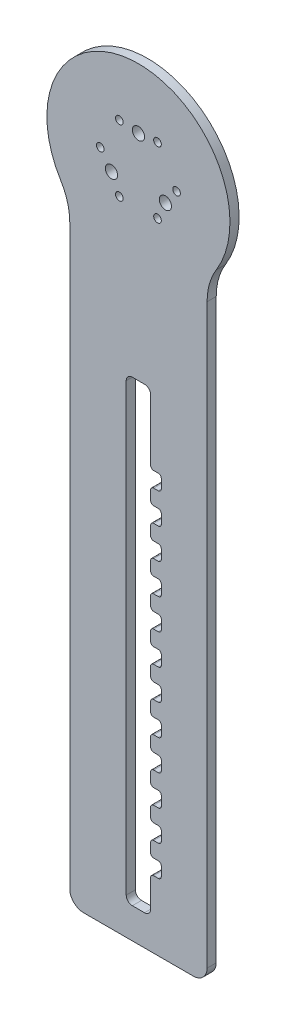
from build123d import *

# Parameters (mm, degrees)
SKETCH_1_R          = 1.25
SKETCH_1_R_2        = 2
EXTRUDE_1_DEPTH     = 3
SKETCH_2_R          = 2.5
CUT_EXTRUDE_1_DEPTH = 1
CUT_EXTRUDE_2_DEPTH = 10


with BuildPart() as part:
    # 草图1 → 凸台-拉伸1 (new body)
    with BuildSketch(Plane.XY):
        with BuildLine():
            Line((-17.988253832, -110), (17.988253832, -110))
            ThreePointArc((17.988253832, -110), (21.178540142, -108.678540142), (22.5, -105.488253832))
            Line((22.5, -105.488253832), (22.5, 83.660865618))
            ThreePointArc((22.5, 83.660865618), (23.264615938, 89.138091193), (25.5, 94.196519371))
            ThreePointArc((25.5, 94.196519371), (0, 140), (-25.5, 94.196519371))
            ThreePointArc((-25.5, 94.196519371), (-23.264615938, 89.138091193), (-22.5, 83.660865618))
            Line((-22.5, 83.660865618), (-22.5, -105.488253832))
            ThreePointArc((-22.5, -105.488253832), (-21.178540142, -108.678540142), (-17.988253832, -110))
        make_face()
        with Locations((12.5, 110)):
            Circle(SKETCH_1_R, mode=Mode.SUBTRACT)
        with Locations((6.25, 120.825317547)):
            Circle(SKETCH_1_R, mode=Mode.SUBTRACT)
        with Locations((-6.25, 120.825317547)):
            Circle(SKETCH_1_R, mode=Mode.SUBTRACT)
        with Locations((-12.5, 110)):
            Circle(SKETCH_1_R, mode=Mode.SUBTRACT)
        with Locations((-6.25, 99.174682453)):
            Circle(SKETCH_1_R, mode=Mode.SUBTRACT)
        with Locations((6.25, 99.174682453)):
            Circle(SKETCH_1_R, mode=Mode.SUBTRACT)
        with Locations((0, 120.2)):
            Circle(SKETCH_1_R_2, mode=Mode.SUBTRACT)
        with Locations((-8.833459119, 104.9)):
            Circle(SKETCH_1_R_2, mode=Mode.SUBTRACT)
        with Locations((8.833459119, 104.9)):
            Circle(SKETCH_1_R_2, mode=Mode.SUBTRACT)
    extrude(amount=EXTRUDE_1_DEPTH)

    # 草图2 → 切除-拉伸1 (cut)
    with BuildSketch(Plane(origin=(0, 0, 0), x_dir=(-1, 0, 0), z_dir=(0, 0, -1))):
        with Locations((-6.25, 120.825317547)):
            Circle(SKETCH_2_R)
        with Locations((6.25, 120.825317547)):
            Circle(SKETCH_2_R)
        with Locations((12.5, 110)):
            Circle(SKETCH_2_R)
        with Locations((6.25, 99.174682453)):
            Circle(SKETCH_2_R)
        with Locations((-6.25, 99.174682453)):
            Circle(SKETCH_2_R)
        with Locations((-12.5, 110)):
            Circle(SKETCH_2_R)
    extrude(amount=-CUT_EXTRUDE_1_DEPTH, mode=Mode.SUBTRACT)

    # 草图3 → 切除-拉伸2 (cut)
    with BuildSketch(Plane(origin=(0, 0, 0), x_dir=(-1, 0, 0), z_dir=(0, 0, -1))):
        with BuildLine():
            Line((-4, -79), (-4, -82))
            ThreePointArc((-4, -82), (-4.292893219, -82.707106781), (-5, -83))
            Line((-5, -83), (-6.5, -83))
            ThreePointArc((-6.5, -83), (-7.207106781, -83.292893219), (-7.5, -84))
            Line((-7.5, -84), (-7.5, -87))
            ThreePointArc((-7.5, -87), (-7.207106781, -87.707106781), (-6.5, -88))
            Line((-6.5, -88), (-5, -88))
            ThreePointArc((-5, -88), (-4.292893219, -88.292893219), (-4, -89))
            Line((-4, -89), (-4, -98))
            ThreePointArc((-4, -98), (-3.414213562, -99.414213562), (-2, -100))
            Line((-2, -100), (2, -100))
            ThreePointArc((2, -100), (3.414213562, -99.414213562), (4, -98))
            Line((4, -98), (4, -70))
            Line((4, -70), (4, 48))
            ThreePointArc((4, 48), (3.414213562, 49.414213562), (2, 50))
            Line((2, 50), (-2, 50))
            ThreePointArc((-2, 50), (-3.414213562, 49.414213562), (-4, 48))
            Line((-4, 48), (-4, 28))
            ThreePointArc((-4, 28), (-4.292893219, 27.292893219), (-5, 27))
            Line((-5, 27), (-6.5, 27))
            ThreePointArc((-6.5, 27), (-7.207106781, 26.707106781), (-7.5, 26))
            Line((-7.5, 26), (-7.5, 23))
            ThreePointArc((-7.5, 23), (-7.207106781, 22.292893219), (-6.5, 22))
            Line((-6.5, 22), (-5, 22))
            ThreePointArc((-5, 22), (-4.292893219, 21.707106781), (-4, 21))
            Line((-4, 21), (-4, 18))
            ThreePointArc((-4, 18), (-4.292893219, 17.292893219), (-5, 17))
            Line((-5, 17), (-6.5, 17))
            ThreePointArc((-6.5, 17), (-7.207106781, 16.707106781), (-7.5, 16))
            Line((-7.5, 16), (-7.5, 13))
            ThreePointArc((-7.5, 13), (-7.207106781, 12.292893219), (-6.5, 12))
            Line((-6.5, 12), (-5, 12))
            ThreePointArc((-5, 12), (-4.292893219, 11.707106781), (-4, 11))
            Line((-4, 11), (-4, 8))
            ThreePointArc((-4, 8), (-4.292893219, 7.292893219), (-5, 7))
            Line((-5, 7), (-6.5, 7))
            ThreePointArc((-6.5, 7), (-7.207106781, 6.707106781), (-7.5, 6))
            Line((-7.5, 6), (-7.5, 3))
            ThreePointArc((-7.5, 3), (-7.207106781, 2.292893219), (-6.5, 2))
            Line((-6.5, 2), (-5, 2))
            ThreePointArc((-5, 2), (-4.292893219, 1.707106781), (-4, 1))
            Line((-4, 1), (-4, -2))
            ThreePointArc((-4, -2), (-4.292893219, -2.707106781), (-5, -3))
            Line((-5, -3), (-6.5, -3))
            ThreePointArc((-6.5, -3), (-7.207106781, -3.292893219), (-7.5, -4))
            Line((-7.5, -4), (-7.5, -7))
            ThreePointArc((-7.5, -7), (-7.207106781, -7.707106781), (-6.5, -8))
            Line((-6.5, -8), (-5, -8))
            ThreePointArc((-5, -8), (-4.292893219, -8.292893219), (-4, -9))
            Line((-4, -9), (-4, -12))
            ThreePointArc((-4, -12), (-4.292893219, -12.707106781), (-5, -13))
            Line((-5, -13), (-6.5, -13))
            ThreePointArc((-6.5, -13), (-7.207106781, -13.292893219), (-7.5, -14))
            Line((-7.5, -14), (-7.5, -17))
            ThreePointArc((-7.5, -17), (-7.207106781, -17.707106781), (-6.5, -18))
            Line((-6.5, -18), (-5, -18))
            ThreePointArc((-5, -18), (-4.292893219, -18.292893219), (-4, -19))
            Line((-4, -19), (-4, -22))
            ThreePointArc((-4, -22), (-4.292893219, -22.707106781), (-5, -23))
            Line((-5, -23), (-6.5, -23))
            ThreePointArc((-6.5, -23), (-7.207106781, -23.292893219), (-7.5, -24))
            Line((-7.5, -24), (-7.5, -27))
            ThreePointArc((-7.5, -27), (-7.207106781, -27.707106781), (-6.5, -28))
            Line((-6.5, -28), (-5, -28))
            ThreePointArc((-5, -28), (-4.292893219, -28.292893219), (-4, -29))
            Line((-4, -29), (-4, -32))
            ThreePointArc((-4, -32), (-4.292893219, -32.707106781), (-5, -33))
            Line((-5, -33), (-6.5, -33))
            ThreePointArc((-6.5, -33), (-7.207106781, -33.292893219), (-7.5, -34))
            Line((-7.5, -34), (-7.5, -37))
            ThreePointArc((-7.5, -37), (-7.207106781, -37.707106781), (-6.5, -38))
            Line((-6.5, -38), (-5, -38))
            ThreePointArc((-5, -38), (-4.292893219, -38.292893219), (-4, -39))
            Line((-4, -39), (-4, -42))
            ThreePointArc((-4, -42), (-4.292893219, -42.707106781), (-5, -43))
            Line((-5, -43), (-6.5, -43))
            ThreePointArc((-6.5, -43), (-7.207106781, -43.292893219), (-7.5, -44))
            Line((-7.5, -44), (-7.5, -47))
            ThreePointArc((-7.5, -47), (-7.207106781, -47.707106781), (-6.5, -48))
            Line((-6.5, -48), (-5, -48))
            ThreePointArc((-5, -48), (-4.292893219, -48.292893219), (-4, -49))
            Line((-4, -49), (-4, -52))
            ThreePointArc((-4, -52), (-4.292893219, -52.707106781), (-5, -53))
            Line((-5, -53), (-6.5, -53))
            ThreePointArc((-6.5, -53), (-7.207106781, -53.292893219), (-7.5, -54))
            Line((-7.5, -54), (-7.5, -57))
            ThreePointArc((-7.5, -57), (-7.207106781, -57.707106781), (-6.5, -58))
            Line((-6.5, -58), (-5, -58))
            ThreePointArc((-5, -58), (-4.292893219, -58.292893219), (-4, -59))
            Line((-4, -59), (-4, -62))
            ThreePointArc((-4, -62), (-4.292893219, -62.707106781), (-5, -63))
            Line((-5, -63), (-6.5, -63))
            ThreePointArc((-6.5, -63), (-7.207106781, -63.292893219), (-7.5, -64))
            Line((-7.5, -64), (-7.5, -67))
            ThreePointArc((-7.5, -67), (-7.207106781, -67.707106781), (-6.5, -68))
            Line((-6.5, -68), (-5, -68))
            ThreePointArc((-5, -68), (-4.292893219, -68.292893219), (-4, -69))
            Line((-4, -69), (-4, -72))
            ThreePointArc((-4, -72), (-4.292893219, -72.707106781), (-5, -73))
            Line((-5, -73), (-6.5, -73))
            ThreePointArc((-6.5, -73), (-7.207106781, -73.292893219), (-7.5, -74))
            Line((-7.5, -74), (-7.5, -77))
            ThreePointArc((-7.5, -77), (-7.207106781, -77.707106781), (-6.5, -78))
            Line((-6.5, -78), (-5, -78))
            ThreePointArc((-5, -78), (-4.292893219, -78.292893219), (-4, -79))
        make_face()
    extrude(amount=-CUT_EXTRUDE_2_DEPTH, mode=Mode.SUBTRACT)


solid = part.part
